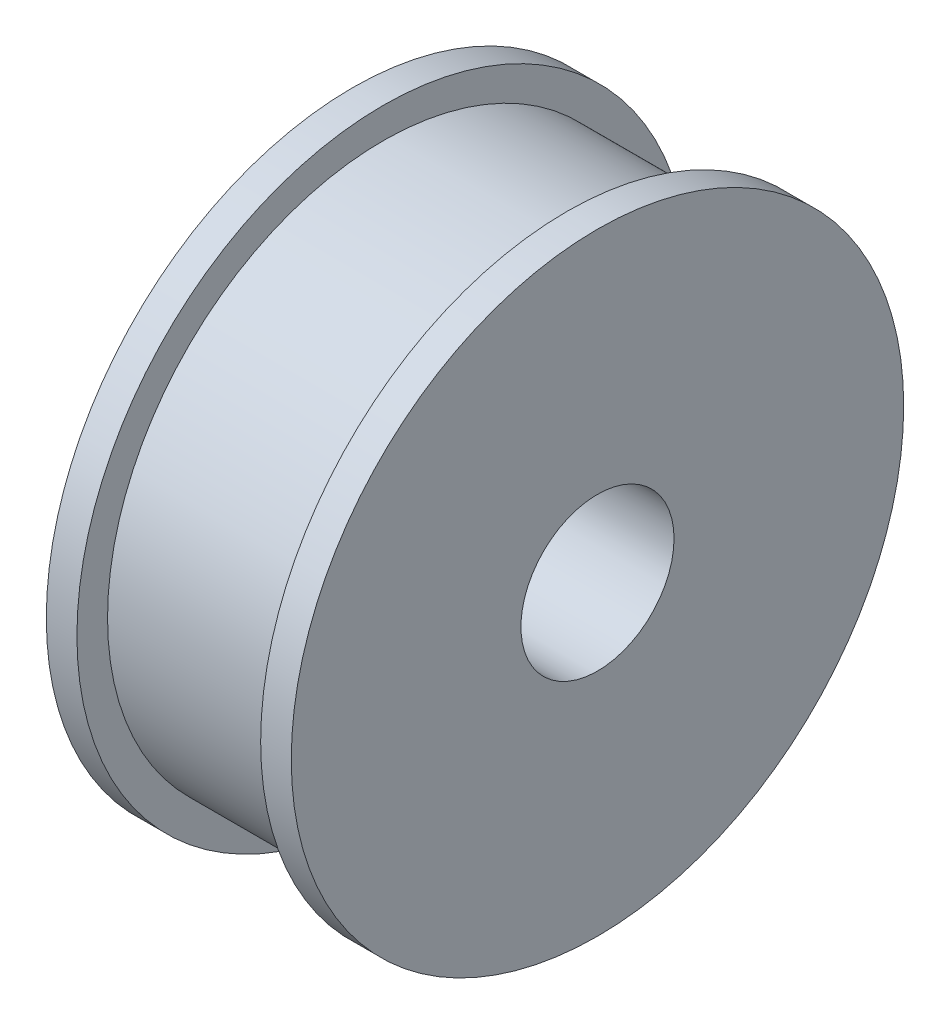
from build123d import *

# Parameters (mm, degrees)
CUT_EXTRUDE1_REACH = 22.635
SKETCH3_R          = 3.175


with BuildPart() as part:
    # Sketch2 → Revolve1 (revolve)
    with BuildSketch(Plane.XY, mode=Mode.PRIVATE) as revolve1_sk:
        Polygon((5.08, 0), (-5.08, 0), (-5.08, 12.7), (-3.81, 12.7), (-3.81, 11.43), (3.81, 11.43), (3.81, 12.7), (5.08, 12.7), align=None)
    revolve(revolve1_sk.sketch.rotate(Axis((-12.271623249, 0, 0), (1, 0, 0)), 90), axis=Axis((-12.271623249, 0, 0), (1, 0, 0)))

    # Sketch3 → Cut-Extrude1 (cut, up to next)
    with BuildSketch(Plane(origin=(5.08, 0, 0), x_dir=(0, 0, -1), z_dir=(1, 0, 0)), mode=Mode.PRIVATE) as cut_extrude1_sk1:
        Circle(SKETCH3_R)
    cut_extrude1_tool1 = extrude(cut_extrude1_sk1.sketch, amount=-CUT_EXTRUDE1_REACH, mode=Mode.PRIVATE) & part.part
    add(cut_extrude1_tool1.solids().sort_by_distance((5.08, 0, 0))[0], mode=Mode.SUBTRACT)


solid = part.part
